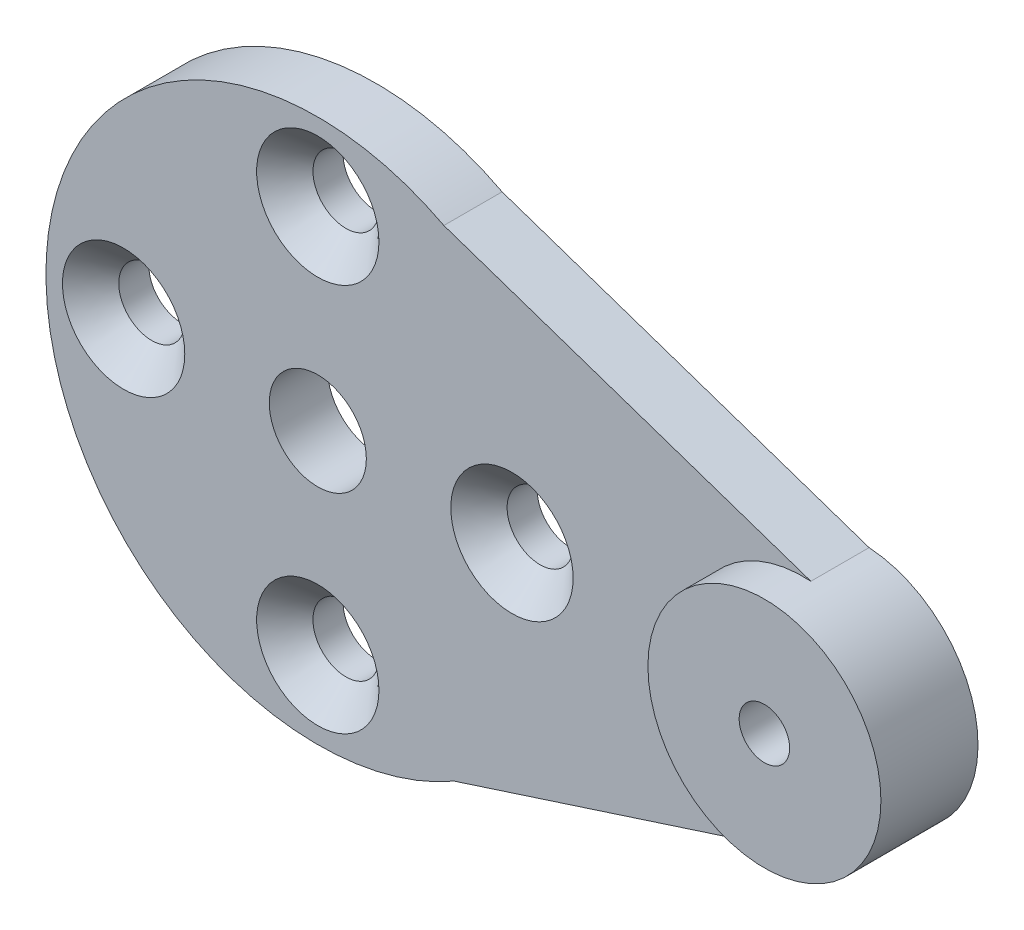
from build123d import *

# Parameters (mm, degrees)
BOSS_EXTRUDE1_DEPTH                                 = 3
SKETCH2_R                                           = 6
BOSS_EXTRUDE2_DEPTH                                 = 2
TAP_DRILL_FOR_M3X0_5_TAP1_D                         = 2.6
SKETCH5_R                                           = 2.5
CUT_EXTRUDE1_DEPTH                                  = 35.146742158
CSK_FOR_M3_FLAT_COUNTERSUNK_HEAD_SCREW1_D           = 3.4
CSK_FOR_M3_FLAT_COUNTERSUNK_HEAD_SCREW1_DEPTH       = 6
CSK_FOR_M3_FLAT_COUNTERSUNK_HEAD_SCREW1_CSINK_D     = 6.3
CSK_FOR_M3_FLAT_COUNTERSUNK_HEAD_SCREW1_CSINK_ANGLE = 90
CSK_FOR_M3_FLAT_COUNTERSUNK_HEAD_SCREW1_TIP         = 1.021463052


with BuildPart() as part:
    # Sketch1 → Boss-Extrude1 (new body)
    with BuildSketch(Plane.XY):
        with BuildLine():
            Line((6.492075468, 12.403747664), (25.393424513, 5.987087535))
            ThreePointArc((25.393424513, 5.987087535), (30.969865577, 0.600587203), (26.5781102, -5.788744959))
            Line((26.5781102, -5.788744959), (7.022947864, -12.11107771))
            ThreePointArc((7.022947864, -12.11107771), (-13.996718533, -0.30310114), (6.492075468, 12.403747664))
        make_face()
    extrude(amount=BOSS_EXTRUDE1_DEPTH)

    # Sketch2 → Boss-Extrude2 (add)
    with BuildSketch(Plane.XY.offset(3)):
        with Locations(Location((25, 0, 0), (0, 0, 86.240375256))):
            Circle(SKETCH2_R)
    extrude(amount=BOSS_EXTRUDE2_DEPTH)

    # Tap Drill for M3x0.5 Tap1 (through all)
    with Locations(Plane.XY.offset(5)):
        with Locations((25, 0)):
            Hole(TAP_DRILL_FOR_M3X0_5_TAP1_D / 2)

    # Sketch5 → Cut-Extrude1 (cut, through all)
    with BuildSketch(Plane.XY.offset(3)):
        Circle(SKETCH5_R)
    extrude(amount=-CUT_EXTRUDE1_DEPTH, mode=Mode.SUBTRACT)

    # CSK for M3 Flat Countersunk Head Screw1
    with Locations(Plane.XY.offset(3)):
        with Locations((0, 10), (-10, 0), (0, -10), (10, 0)):
            CounterSinkHole(CSK_FOR_M3_FLAT_COUNTERSUNK_HEAD_SCREW1_D / 2, CSK_FOR_M3_FLAT_COUNTERSUNK_HEAD_SCREW1_CSINK_D / 2, depth=CSK_FOR_M3_FLAT_COUNTERSUNK_HEAD_SCREW1_DEPTH, counter_sink_angle=CSK_FOR_M3_FLAT_COUNTERSUNK_HEAD_SCREW1_CSINK_ANGLE)
            with Locations((0, 0, -(CSK_FOR_M3_FLAT_COUNTERSUNK_HEAD_SCREW1_DEPTH + CSK_FOR_M3_FLAT_COUNTERSUNK_HEAD_SCREW1_TIP / 2))):  # 118° drill point
                Cone(0, CSK_FOR_M3_FLAT_COUNTERSUNK_HEAD_SCREW1_D / 2, CSK_FOR_M3_FLAT_COUNTERSUNK_HEAD_SCREW1_TIP, mode=Mode.SUBTRACT)


solid = part.part
